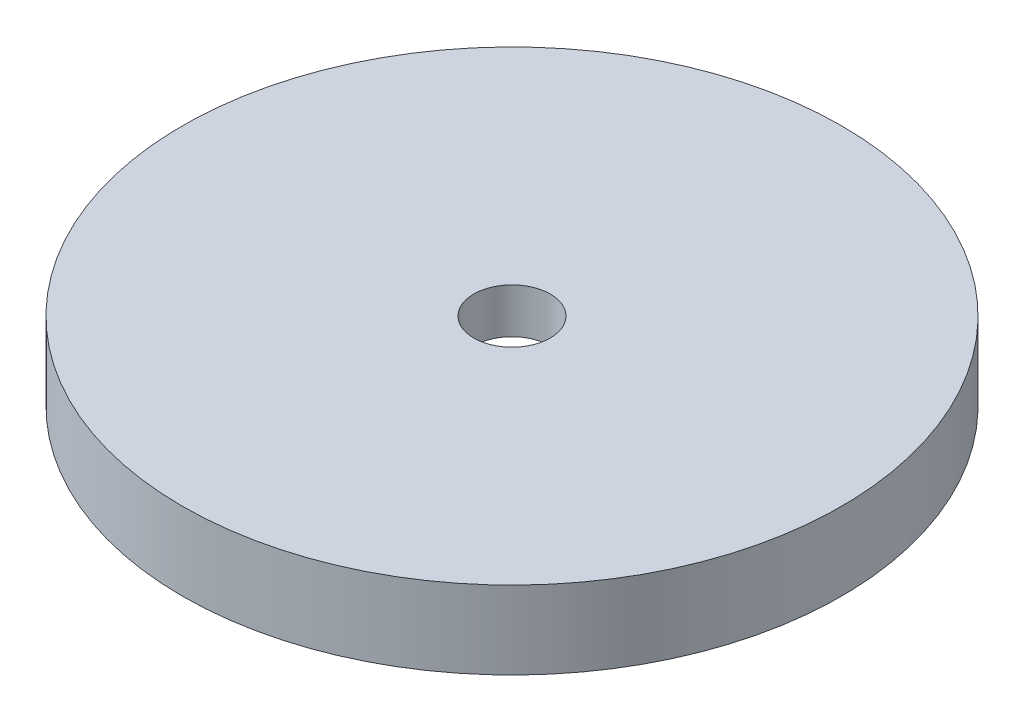
from build123d import *

# Parameters (mm, degrees)
SKETCH1_R           = 22
SKETCH1_R_2         = 2.55
BOSS_EXTRUDE1_DEPTH = 5.2
SKETCH2_R           = 21
CUT_EXTRUDE1_DEPTH  = 2.2


with BuildPart() as part:
    # Sketch1 → Boss-Extrude1 (new body)
    with BuildSketch(Plane(origin=(0, 0, 0), x_dir=(1, 0, 0), z_dir=(0, 1, 0))):
        with Locations(Location((0, 0, 0), (0, 0, 270))):
            Circle(SKETCH1_R)
        with Locations(Location((0, 0, 0), (0, 0, 270))):
            Circle(SKETCH1_R_2, mode=Mode.SUBTRACT)
    extrude(amount=BOSS_EXTRUDE1_DEPTH)

    # Sketch2 → Cut-Extrude1 (cut)
    with BuildSketch(Plane.XZ):
        with Locations(Location((0, 0, 0), (0, 0, 270))):
            Circle(SKETCH2_R)
    extrude(amount=-CUT_EXTRUDE1_DEPTH, mode=Mode.SUBTRACT)


solid = part.part
